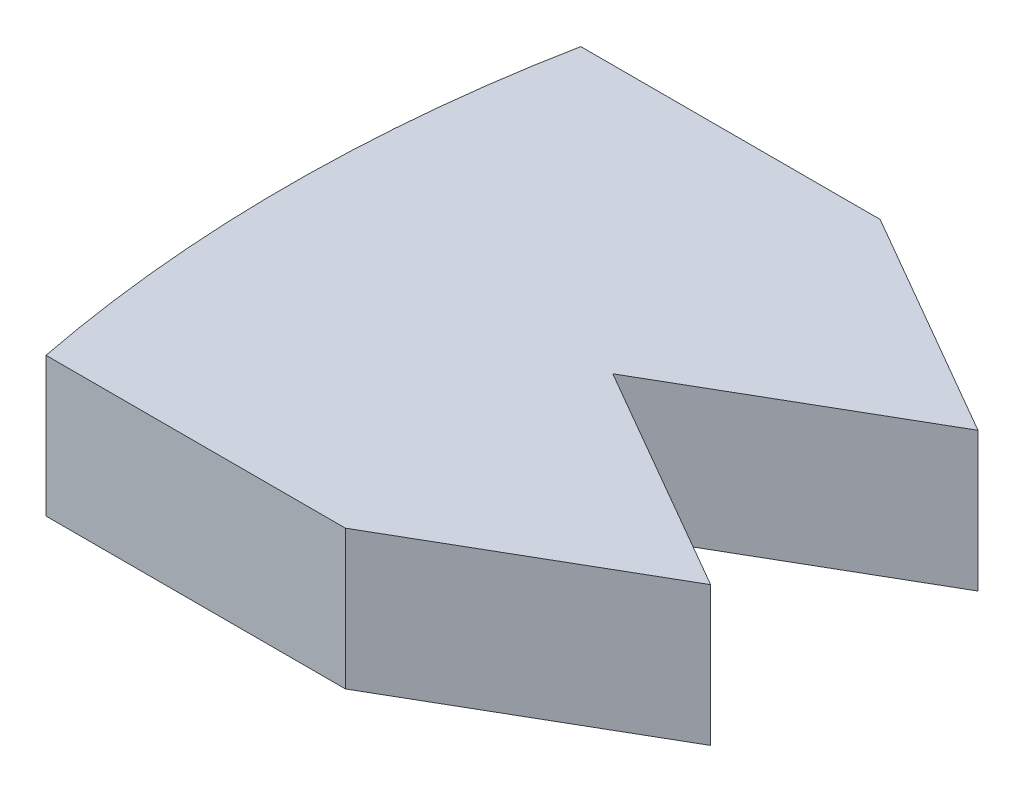
from build123d import *

# Parameters (mm, degrees)
BOSS_EXTRUDE1_DEPTH = 6.35


with BuildPart() as part:
    # Sketch2 → Boss-Extrude1 (new body)
    with BuildSketch(Plane(origin=(0, 0, 0), x_dir=(1, 0, 0), z_dir=(0, 1, 0))):
        with BuildLine():
            Line((-50.75013925, 9.494238665), (-40.191557527, 3.398238665))
            Line((-40.191557527, 3.398238665), (-50.75013925, -2.697761335))
            Line((-50.75013925, -2.697761335), (-40.191557527, -8.793761335))
            Line((-40.191557527, -8.793761335), (-50.75013925, -14.889761335))
            Line((-50.75013925, -14.889761335), (-64.40263925, -14.889761335))
            ThreePointArc((-64.40263925, -14.889761335), (-65.584061474, -2.697761335), (-64.40263925, 9.494238665))
            Line((-64.40263925, 9.494238665), (-50.75013925, 9.494238665))
        make_face()
    extrude(amount=BOSS_EXTRUDE1_DEPTH)


solid = part.part
